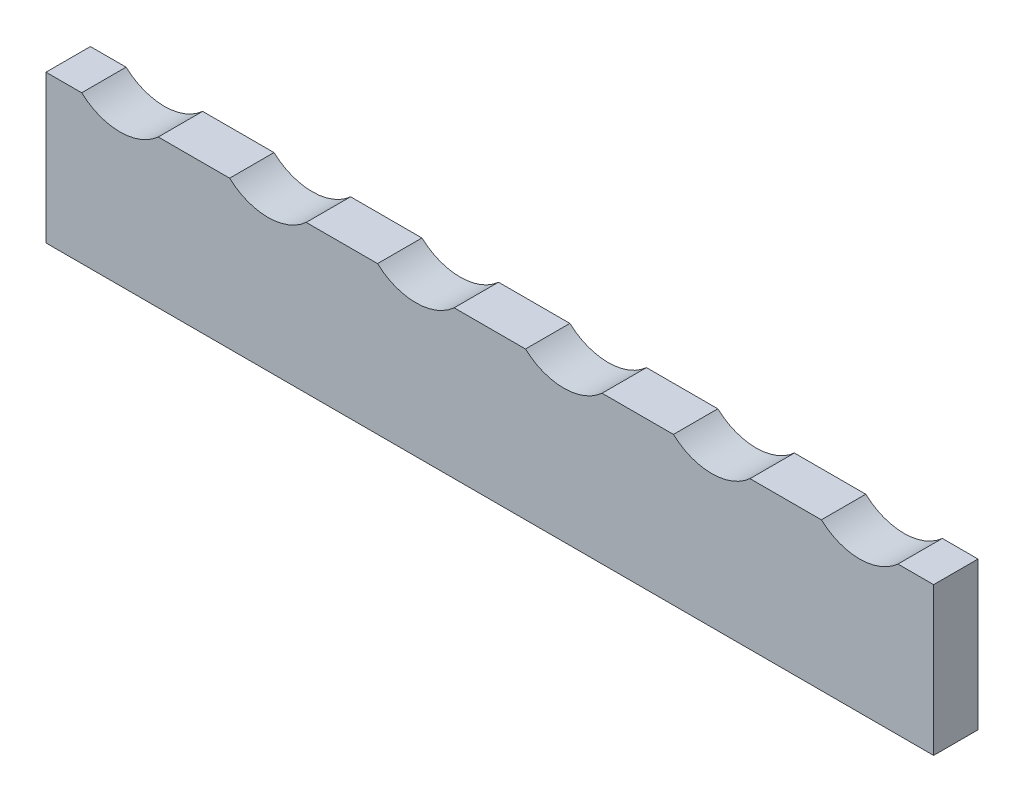
from build123d import *

# Parameters (mm, degrees)
ESQUISSE1_W                  = 600
ESQUISSE1_H                  = 100
BOSS_EXTRU_1_DEPTH           = 30
ENL_V_MAT_EXTRU_1_DEPTH      = 610.015599143
ENL_V_MAT_EXTRU_1_DEPTH_BACK = 610.015599143
ESQUISSE2_R                  = 38.5


with BuildPart() as part:
    # Esquisse1 → Boss.-Extru.1 (new body)
    with BuildSketch(Plane.XY):
        with Locations((300, 50)):
            Rectangle(ESQUISSE1_W, ESQUISSE1_H)
    extrude(amount=BOSS_EXTRU_1_DEPTH)

    # Esquisse2 → Enlèv. mat.-Extru.1 (cut, two sides: drawn at the far end of the back side and taken through both)
    with BuildSketch(Plane.XY.offset(30).offset(-ENL_V_MAT_EXTRU_1_DEPTH_BACK)):
        with Locations((50, 128.5)):
            Circle(ESQUISSE2_R)
        with Locations((150, 128.5)):
            Circle(ESQUISSE2_R)
        with Locations((250, 128.5)):
            Circle(ESQUISSE2_R)
        with Locations((350, 128.5)):
            Circle(ESQUISSE2_R)
        with Locations((450, 128.5)):
            Circle(ESQUISSE2_R)
        with Locations((550, 128.5)):
            Circle(ESQUISSE2_R)
    extrude(amount=ENL_V_MAT_EXTRU_1_DEPTH + ENL_V_MAT_EXTRU_1_DEPTH_BACK, mode=Mode.SUBTRACT)


solid = part.part
